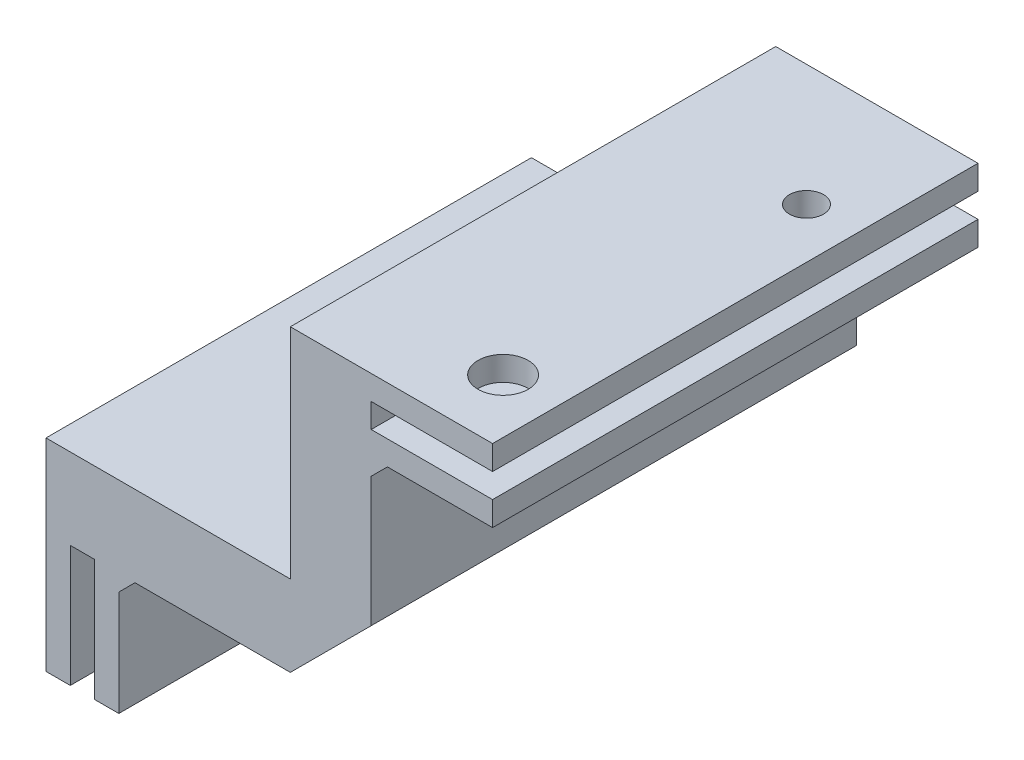
from build123d import *

# Parameters (mm, degrees)
DODANIE_WYCI_GNI_CIE1_DEPTH = 60
SFAZOWANIE1_SIZE            = 10
SFAZOWANIE2_SIZE            = 2
SZKIC4_R                    = 3.1
WYTNIJ_WYCI_GNI_CIE1_DEPTH  = 10
SZKIC5_R                    = 2.1
WYTNIJ_WYCI_GNI_CIE2_DEPTH  = 10
SZKIC6_R                    = 2.1
WYTNIJ_WYCI_GNI_CIE3_DEPTH  = 10


with BuildPart() as part:
    # Szkic1 → Dodanie-wyciągnięcie1 (new body)
    with BuildSketch(Plane.XY):
        Polygon((0, 0), (3, 0), (3, 15), (6, 15), (6, 0), (9, 0), (9, 15), (40.2, 15), (40.2, 43), (55.2, 43), (55.2, 46), (40.2, 46), (40.2, 49), (55.2, 49), (55.2, 52), (40.2, 52), (30.2, 52), (30.2, 25), (9, 25), (0, 25), align=None)
    extrude(amount=DODANIE_WYCI_GNI_CIE1_DEPTH)

    # Sfazowanie1
    sfazowanie1_edges = [part.edges().sort_by_distance(p)[0] for p in [
        (40.2, 15, 30),
    ]]
    chamfer(sfazowanie1_edges, length=SFAZOWANIE1_SIZE)

    # Sfazowanie2
    sfazowanie2_edges = [part.edges().sort_by_distance(p)[0] for p in [
        (40.2, 43, 30),
        (9, 15, 30),
    ]]
    chamfer(sfazowanie2_edges, length=SFAZOWANIE2_SIZE)

    # Szkic4 → Wytnij-wyciągnięcie1 (cut)
    with BuildSketch(Plane.XZ.offset(-43)):
        with Locations(Location((48.5, 52, 0), (0, 0, 270))):
            Circle(SZKIC4_R)
    extrude(amount=-WYTNIJ_WYCI_GNI_CIE1_DEPTH, mode=Mode.SUBTRACT)

    # Szkic5 → Wytnij-wyciągnięcie2 (cut)
    with BuildSketch(Plane.XZ.offset(-43)):
        with Locations(Location((49, 15, 0), (0, 0, 270))):
            Circle(SZKIC5_R)
    extrude(amount=-WYTNIJ_WYCI_GNI_CIE2_DEPTH, mode=Mode.SUBTRACT)

    # Szkic6 → Wytnij-wyciągnięcie3 (cut)
    with BuildSketch(Plane(origin=(9, 0, 0), x_dir=(0, 0, -1), z_dir=(1, 0, 0))):
        with Locations((-15, 6)):
            Circle(SZKIC6_R)
    extrude(amount=-WYTNIJ_WYCI_GNI_CIE3_DEPTH, mode=Mode.SUBTRACT)


solid = part.part
